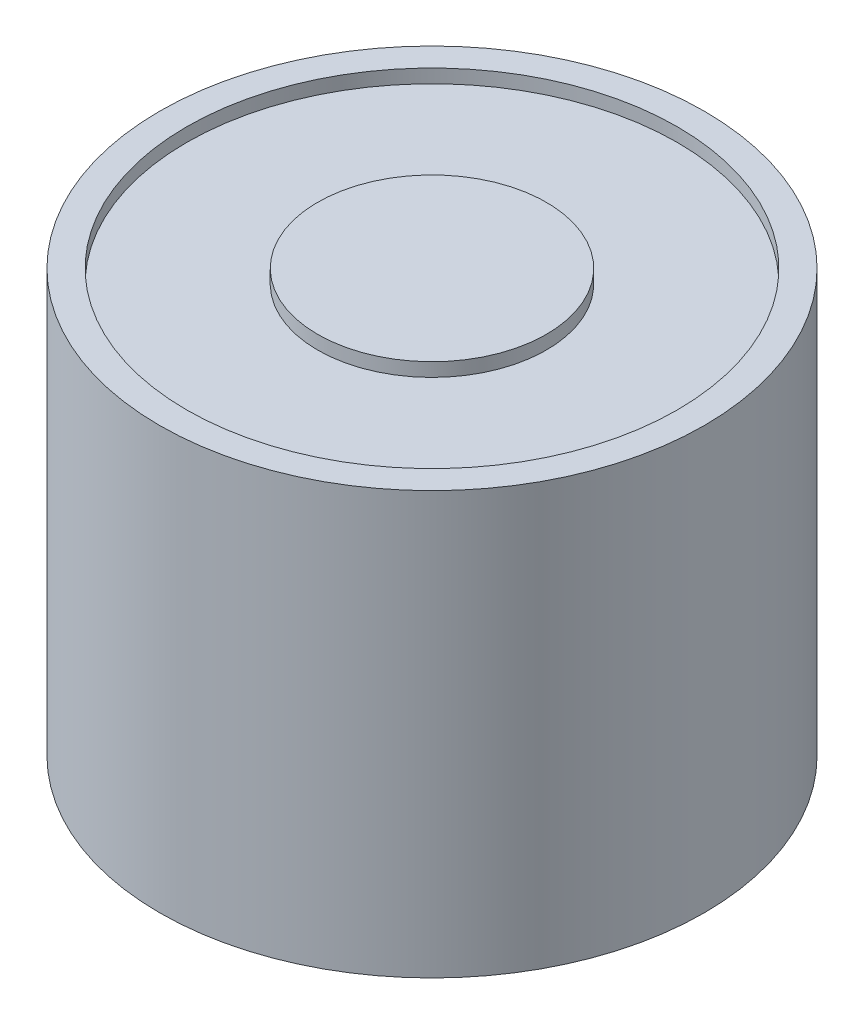
from build123d import *

# Parameters (mm, degrees)
SKETCH1_R           = 10
BOSS_EXTRUDE1_DEPTH = 15
SKETCH2_R           = 10
SKETCH2_R_2         = 9.008877903
BOSS_EXTRUDE2_DEPTH = 0.5
SKETCH3_R           = 4.201144216
BOSS_EXTRUDE3_DEPTH = 0.5


with BuildPart() as part:
    # Sketch1 → Boss-Extrude1 (new body)
    with BuildSketch(Plane(origin=(0, 0, 0), x_dir=(1, 0, 0), z_dir=(0, 1, 0))):
        with Locations(Location((0, 0, 0), (0, 0, 270))):
            Circle(SKETCH1_R)
    extrude(amount=BOSS_EXTRUDE1_DEPTH)

    # Sketch2 → Boss-Extrude2 (add)
    with BuildSketch(Plane(origin=(0, 15, 0), x_dir=(1, 0, 0), z_dir=(0, 1, 0))):
        with Locations(Location((0, 0, 0), (0, 0, 270))):
            Circle(SKETCH2_R)
        with Locations(Location((0, 0, 0), (0, 0, 270))):
            Circle(SKETCH2_R_2, mode=Mode.SUBTRACT)
    extrude(amount=BOSS_EXTRUDE2_DEPTH)

    # Sketch3 → Boss-Extrude3 (add)
    with BuildSketch(Plane(origin=(0, 15, 0), x_dir=(1, 0, 0), z_dir=(0, 1, 0))):
        with Locations(Location((0, 0, 0), (0, 0, 270))):
            Circle(SKETCH3_R)
    extrude(amount=BOSS_EXTRUDE3_DEPTH)


solid = part.part
